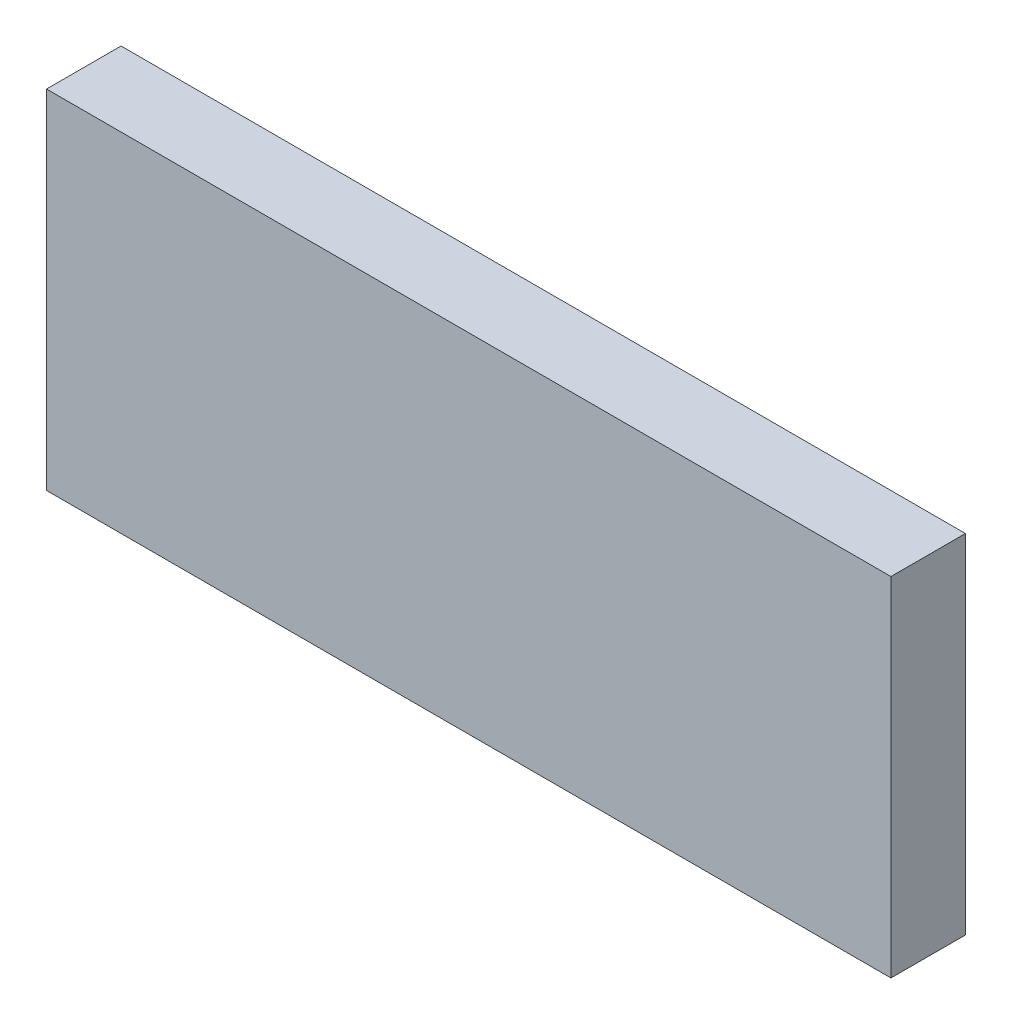
from build123d import *

# Parameters (mm, degrees)
SKETCH1_W           = 215.9
SKETCH1_H           = 88.9
BOSS_EXTRUDE1_DEPTH = 19.05


with BuildPart() as part:
    # Sketch1 → Boss-Extrude1 (new body)
    with BuildSketch(Plane.XY):
        with Locations((107.95, 44.45)):
            Rectangle(SKETCH1_W, SKETCH1_H)
    extrude(amount=BOSS_EXTRUDE1_DEPTH)


solid = part.part
